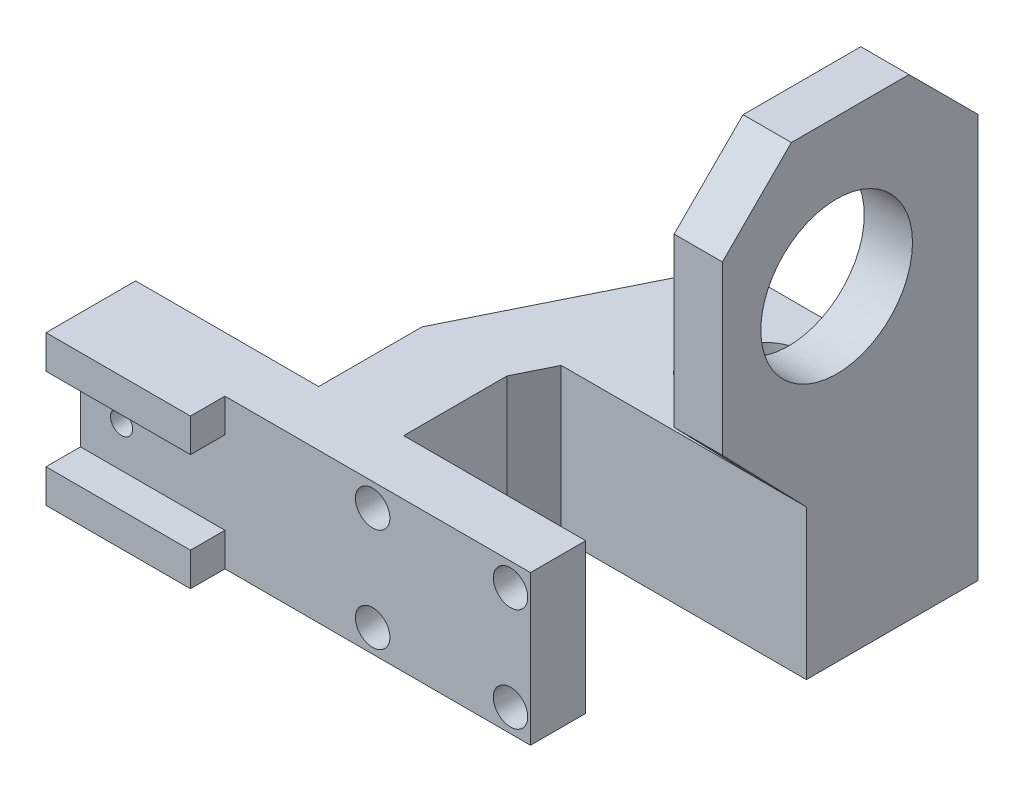
from build123d import *

# Parameters (mm, degrees)
SKICA1_W                 = 50.278910674
SKICA1_H                 = 21.7
SKICA1_R                 = 1.6
P_IDAT_VYSUNUT_M1_DEPTH  = 8
SKICA2_R                 = 2.5
ODEBRAT_VYSUNUT_M1_DEPTH = 4
SKICA4_W                 = 12.327690559
SKICA4_H                 = 21.7
P_IDAT_VYSUNUT_M2_DEPTH  = 15
SKICA6_R                 = 5.406276896
P_IDAT_VYSUNUT_M3_DEPTH  = 21.7
SKICA7_R                 = 1.5
ODEBRAT_VYSUNUT_M3_DEPTH = 21.7
SKICA8_W                 = 8
SKICA8_H                 = 21.7
P_IDAT_VYSUNUT_M4_DEPTH  = 15
SKICA9_R                 = 1.6
ODEBRAT_VYSUNUT_M4_DEPTH = 15
SKICA10_R                = 11
P_IDAT_VYSUNUT_M5_DEPTH  = 7
ZKOSEN_1_SIZE            = 10
SKICA11_W                = 20.957821349
SKICA11_H                = 4.85
P_IDAT_VYSUNUT_M6_DEPTH  = 5


with BuildPart() as part:
    # Skica1 → Přidat vysunutím1 (new body)
    with BuildSketch(Plane.XY):
        with Locations((-8.927473885, -9.09140889)):
            Rectangle(SKICA1_W, SKICA1_H)
        with Locations((13.311981452, -16.59140889)):
            Circle(SKICA1_R, mode=Mode.SUBTRACT)
        with Locations((-6.688018548, -16.59140889)):
            Circle(SKICA1_R, mode=Mode.SUBTRACT)
        with Locations((-6.688018548, -1.59140889)):
            Circle(SKICA1_R, mode=Mode.SUBTRACT)
        with Locations((13.311981452, -1.59140889)):
            Circle(SKICA1_R, mode=Mode.SUBTRACT)
    extrude(amount=P_IDAT_VYSUNUT_M1_DEPTH)

    # Skica2 → Odebrat vysunutím1 (cut)
    with BuildSketch(Plane.XY.offset(8)):
        with Locations((13.311981452, -16.59140889)):
            Circle(SKICA2_R)
        with Locations((-6.688018548, -16.59140889)):
            Circle(SKICA2_R)
        with Locations((-6.688018548, -1.59140889)):
            Circle(SKICA2_R)
        with Locations((13.311981452, -1.59140889)):
            Circle(SKICA2_R)
    extrude(amount=-ODEBRAT_VYSUNUT_M1_DEPTH, mode=Mode.SUBTRACT)

    # Skica4 → Přidat vysunutím2 (add)
    with BuildSketch(Plane(origin=(0, 0, 0), x_dir=(-1, 0, 0), z_dir=(0, 0, -1))):
        with Locations((16.351863828, -9.09140889)):
            Rectangle(SKICA4_W, SKICA4_H)
    extrude(amount=P_IDAT_VYSUNUT_M2_DEPTH)

    # Skica6 → Přidat vysunutím3 (add)
    with BuildSketch(Plane(origin=(0, 1.75859111, 0), x_dir=(1, 0, 0), z_dir=(0, 1, 0))):
        Polygon((-22.515709107, 15), (-10.188018548, 15), (-7.585826442, 20.254970434), (20.97371307, 20.254970434), (20.97371307, 45.15), (4.741864117, 45.15), (-7.585826442, 45.15), align=None)
        with Locations(Location((8.208247023, 34.15, 0), (0, 0, 270))):
            Circle(SKICA6_R, mode=Mode.SUBTRACT)
    extrude(amount=-P_IDAT_VYSUNUT_M3_DEPTH)

    # Skica7 → Odebrat vysunutím3 (cut)
    with BuildSketch(Plane.XZ.offset(19.94140889)):
        with Locations(Location((2.551392773, -28.493145751, 0), (0, 0, 270))):
            Circle(SKICA7_R)
        with Locations(Location((13.865101272, -39.806854249, 0), (0, 0, 270))):
            Circle(SKICA7_R)
    extrude(amount=-ODEBRAT_VYSUNUT_M3_DEPTH, mode=Mode.SUBTRACT)

    # Skica8 → Přidat vysunutím4 (add)
    with BuildSketch(Plane.ZY.offset(34.066929222)):
        with Locations((4, -9.09140889)):
            Rectangle(SKICA8_W, SKICA8_H)
    extrude(amount=P_IDAT_VYSUNUT_M4_DEPTH)

    # Skica9 → Odebrat vysunutím4 (cut)
    with BuildSketch(Plane.XY.offset(8)):
        with Locations((-43.109107873, -9.09140889)):
            Circle(SKICA9_R)
    extrude(amount=-ODEBRAT_VYSUNUT_M4_DEPTH, mode=Mode.SUBTRACT)

    # Skica10 → Přidat vysunutím5 (add)
    with BuildSketch(Plane(origin=(20.97371307, 0, 0), x_dir=(0, 0, -1), z_dir=(1, 0, 0))):
        Polygon((8.074184901, 14.340387575), (20.254970434, 1.75859111), (20.254970434, -19.94140889), (45.15, -19.94140889), (45.15, 48.622184041), (8.074184901, 48.622184041), align=None)
        with Locations((24.65, 27.25859111)):
            Circle(SKICA10_R, mode=Mode.SUBTRACT)
    extrude(amount=P_IDAT_VYSUNUT_M5_DEPTH)

    # Zkosení1
    zkosen_1_edges = [part.edges().sort_by_distance(p)[0] for p in [
        (24.47371307, 48.622184041, -45.15),
        (24.47371307, 48.622184041, -8.074184901),
    ]]
    chamfer(zkosen_1_edges, length=ZKOSEN_1_SIZE)

    # Skica11 → Přidat vysunutím6 (add)
    with BuildSketch(Plane.XY.offset(8)):
        with Locations((-38.588018548, -0.66640889)):
            Rectangle(SKICA11_W, SKICA11_H)
        with Locations((-38.588018548, -17.51640889)):
            Rectangle(SKICA11_W, SKICA11_H)
    extrude(amount=P_IDAT_VYSUNUT_M6_DEPTH)


solid = part.part
